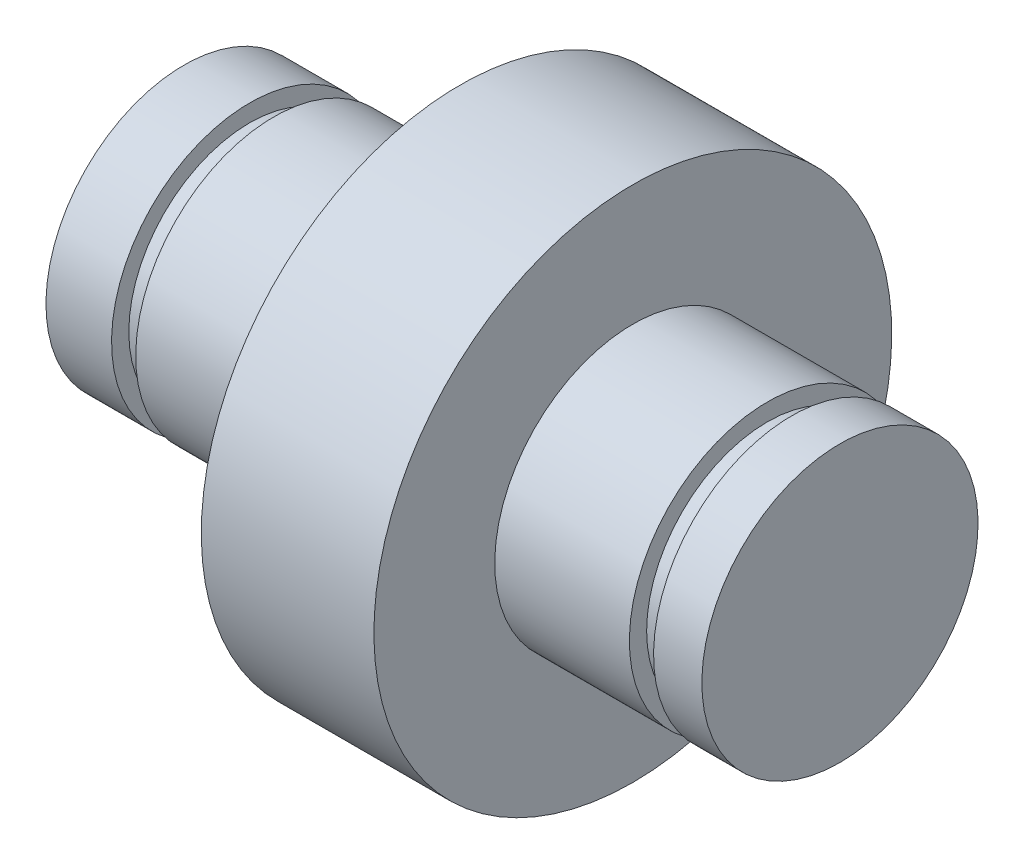
from build123d import *


with BuildPart() as part:
    # Schizzo1 → Rivoluzione1 (revolve)
    with BuildSketch(Plane.XY, mode=Mode.PRIVATE) as rivoluzione1_sk:
        Polygon((-8, 0), (-8, 4), (-6.1, 4), (-6.1, 3.5), (-5.4, 3.5), (-5.4, 4), (0, 4), (0, 7.5), (5, 7.5), (5, 4), (8.9, 4), (8.9, 3.5), (9.6, 3.5), (9.6, 4), (11, 4), (11, 0), align=None)
    revolve(rivoluzione1_sk.sketch.rotate(Axis((-10.800464869, 0, 0), (1, 0, 0)), 180), axis=Axis((-10.800464869, 0, 0), (1, 0, 0)))


solid = part.part
